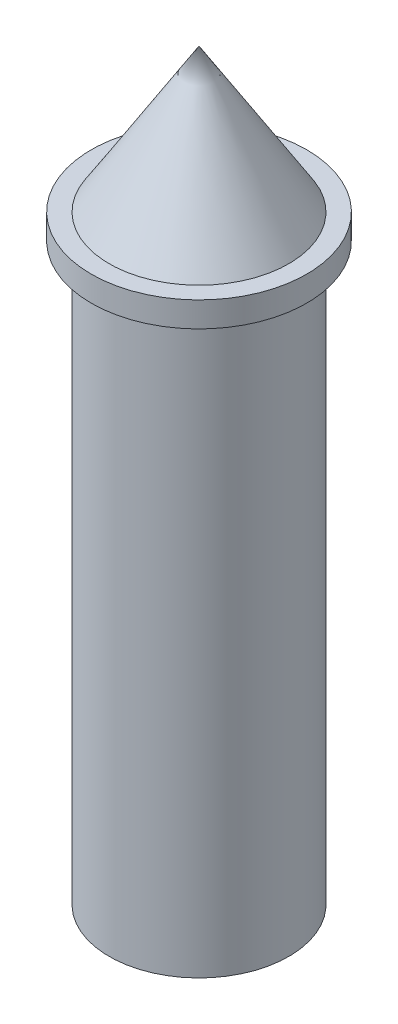
from build123d import *


with BuildPart() as part:
    # Sketch1 → Revolve1 (revolve)
    with BuildSketch(Plane.XY, mode=Mode.PRIVATE) as revolve1_sk:
        Polygon((31.75, 212.09), (0, 262.89), (0, 212.09), (0, 0), (31.75, 0), (31.75, 203.2), (38.1, 203.2), (38.1, 212.09), align=None)
    revolve(revolve1_sk.sketch.rotate(Axis((0, 0, 0), (0, 1, 0)), 90), axis=Axis((0, 0, 0), (0, 1, 0)))


solid = part.part
